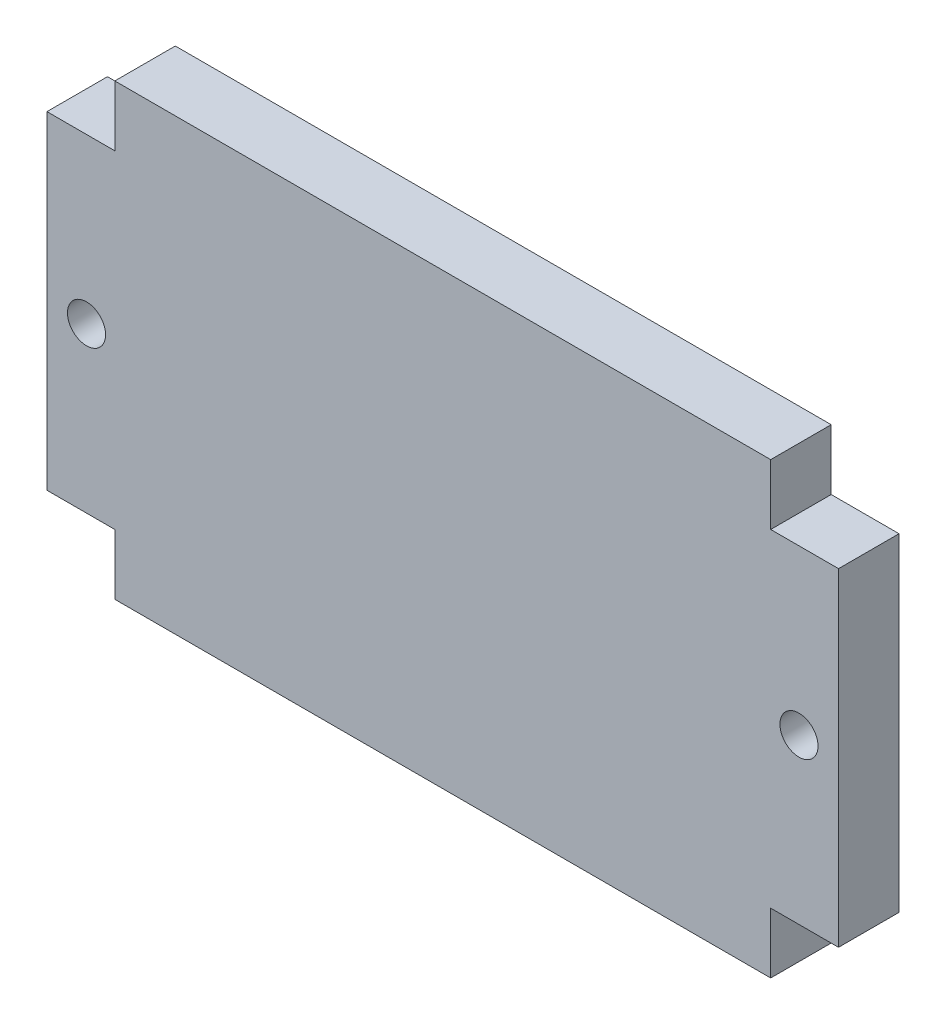
from build123d import *

# Parameters (mm, degrees)
MODEL_R             = 1.685
BOSS_EXTRUDE1_DEPTH = 5.35


with BuildPart() as part:
    # Model → Boss-Extrude1 (new body)
    with BuildSketch(Plane.XY):
        Polygon((-29, 0), (29, 0), (29, 5.35), (35, 5.35), (35, 34.35), (29, 34.35), (29, 39.7), (-29, 39.7), (-29, 34.35), (-35, 34.35), (-35, 5.35), (-29, 5.35), align=None)
        with Locations((-31.5, 19.85)):
            Circle(MODEL_R, mode=Mode.SUBTRACT)
        with Locations(Location((31.5, 19.85, 0), (0, 0, 180))):
            Circle(MODEL_R, mode=Mode.SUBTRACT)
    extrude(amount=BOSS_EXTRUDE1_DEPTH)


solid = part.part
